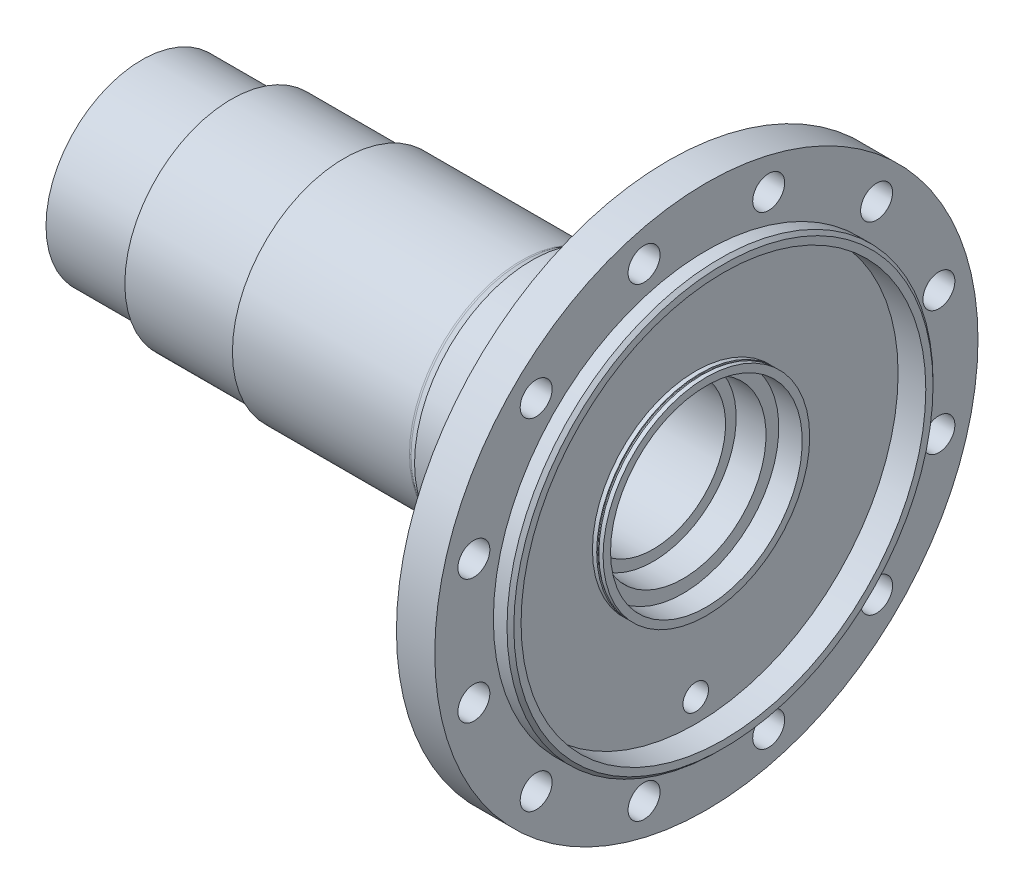
from build123d import *

# Parameters (mm, degrees)
SKETCH_3_W           = 2
SKETCH_3_H           = 46.5
SKETCH_5_W           = 2
SKETCH_5_H           = 46.5
SKETCH_6_R           = 7.5
CUT_EXTRUDE_1_DEPTH  = 328.171973127
SKETCH_7_R           = 7.5
CUT_EXTRUDE_2_DEPTH  = 328.171973127
SKETCH_8_R           = 7.5
CUT_EXTRUDE_3_DEPTH  = 328.171973127
SKETCH_9_R           = 7.5
CUT_EXTRUDE_4_DEPTH  = 328.171973127
SKETCH_10_R          = 7.5
CUT_EXTRUDE_5_DEPTH  = 328.171973127
SKETCH_11_R          = 7.5
CUT_EXTRUDE_6_DEPTH  = 328.171973127
SKETCH_12_R          = 7.5
CUT_EXTRUDE_7_DEPTH  = 328.171973127
SKETCH_13_R          = 7.5
CUT_EXTRUDE_8_DEPTH  = 328.171973127
SKETCH_14_R          = 7.5
CUT_EXTRUDE_9_DEPTH  = 328.171973127
SKETCH_15_R          = 7.5
CUT_EXTRUDE_10_DEPTH = 328.171973127
SKETCH_16_R          = 7.5
CUT_EXTRUDE_11_DEPTH = 328.171973127
SKETCH_17_R          = 7.5
CUT_EXTRUDE_12_DEPTH = 328.171973127
SKETCH_18_R          = 6
CUT_EXTRUDE_13_DEPTH = 328.171973127


with BuildPart() as part:
    # Эскиз1 → Повернуть1 (revolve)
    with BuildSketch(Plane.XY, mode=Mode.PRIVATE) as revolve_1_sk:
        with BuildLine():
            Line((0, 0), (273, 0))
            Line((273, 0), (273, 98.4))
            Line((273, 98.4), (271.4, 100))
            Line((271.4, 100), (265, 100))
            Line((265, 100), (265, 127.5))
            Line((265, 127.5), (247, 127.5))
            Line((247, 127.5), (247, 94.828427125))
            ThreePointArc((247, 94.828427125), (246.847759065, 94.06306026), (246.414213562, 93.414213562))
            Line((246.414213562, 93.414213562), (245, 92))
            Line((245, 92), (245, 82.828427125))
            ThreePointArc((245, 82.828427125), (244.847759065, 82.06306026), (244.414213562, 81.414213562))
            Line((244.414213562, 81.414213562), (241, 78))
            Line((241, 78), (241, 68.328427125))
            ThreePointArc((241, 68.328427125), (240.847759065, 67.56306026), (240.414213562, 66.914213562))
            Line((240.414213562, 66.914213562), (239, 65.5))
            Line((239, 65.5), (239, 64.5))
            ThreePointArc((239, 64.5), (238.414213562, 63.085786438), (237, 62.5))
            Line((237, 62.5), (218, 62.5))
            Line((218, 62.5), (215, 60.767949192))
            Line((215, 60.767949192), (215, 57))
            ThreePointArc((215, 57), (214.414213562, 55.585786438), (213, 55))
            Line((213, 55), (183, 55))
            Line((183, 55), (179.133974596, 52.767949192))
            ThreePointArc((179.133974596, 52.767949192), (178.651612686, 52.568148347), (178.133974596, 52.5))
            Line((178.133974596, 52.5), (95, 52.5))
            Line((95, 52.5), (95, 50))
            Line((95, 50), (42, 50))
            Line((42, 50), (42, 45))
            Line((42, 45), (0, 45))
            Line((0, 45), (0, 0))
        make_face()
    revolve(revolve_1_sk.sketch.rotate(Axis((0, 0, 0), (1, 0, 0)), 90), axis=Axis((0, 0, 0), (1, 0, 0)))

    # Эскиз2 → Вырез-Повернуть1 (revolve, cut)
    with BuildSketch(Plane.XY, mode=Mode.PRIVATE) as cut_revolve_1_sk:
        Polygon((0, 0), (273, 0), (273, 95), (265, 95), (265, 45), (254, 45), (254, 39), (240, 39), (240, 34), (203.5, 34), (203.5, 31), (0, 31), align=None)
    revolve(cut_revolve_1_sk.sketch.rotate(Axis((0, 0, 0), (1, 0, 0)), 90), axis=Axis((0, 0, 0), (1, 0, 0)), mode=Mode.SUBTRACT)

    # Эскиз3 → Rear_recess_left (revolve, cut)
    with BuildSketch(Plane.XY, mode=Mode.PRIVATE) as rear_recess_left_sk:
        with Locations((261, 71.75)):
            Rectangle(SKETCH_3_W, SKETCH_3_H)
    revolve(rear_recess_left_sk.sketch.rotate(Axis((0, 0, 0), (1, 0, 0)), 90), axis=Axis((0, 0, 0), (1, 0, 0)), mode=Mode.SUBTRACT)

    # Эскиз4 → Collar_groove_nominal (revolve, cut)
    with BuildSketch(Plane.XY, mode=Mode.PRIVATE) as collar_groove_nominal_sk:
        with BuildLine():
            Line((263, 48), (263, 95))
            Line((263, 95), (262, 95))
            Line((262, 95), (262, 48))
            ThreePointArc((262, 48), (262.146446609, 47.646446609), (262.5, 47.5))
            ThreePointArc((262.5, 47.5), (262.853553391, 47.646446609), (263, 48))
        make_face()
    revolve(collar_groove_nominal_sk.sketch.rotate(Axis((0, 0, 0), (1, 0, 0)), 90), axis=Axis((0, 0, 0), (1, 0, 0)), mode=Mode.SUBTRACT)

    # Эскиз5 → Rear_recess_lip (revolve, cut)
    with BuildSketch(Plane.XY, mode=Mode.PRIVATE) as rear_recess_lip_sk:
        with Locations((264, 71.75)):
            Rectangle(SKETCH_5_W, SKETCH_5_H)
    revolve(rear_recess_lip_sk.sketch.rotate(Axis((0, 0, 0), (1, 0, 0)), 90), axis=Axis((0, 0, 0), (1, 0, 0)), mode=Mode.SUBTRACT)

    # Эскиз6 → Вырез-Вытянуть1 (cut, through all)
    with BuildSketch(Plane(origin=(0, 0, 0), x_dir=(0, 0, -1), z_dir=(1, 0, 0))):
        with Locations(Location((109.149618371, 29.246552097, 0), (0, 0, 180))):
            Circle(SKETCH_6_R)
    extrude(amount=CUT_EXTRUDE_1_DEPTH, mode=Mode.SUBTRACT)

    # Эскиз7 → Вырез-Вытянуть2 (cut, through all)
    with BuildSketch(Plane(origin=(0, 0, 0), x_dir=(0, 0, -1), z_dir=(1, 0, 0))):
        with Locations(Location((79.903066274, 79.903066274, 0), (0, 0, 180))):
            Circle(SKETCH_7_R)
    extrude(amount=CUT_EXTRUDE_2_DEPTH, mode=Mode.SUBTRACT)

    # Эскиз8 → Вырез-Вытянуть3 (cut, through all)
    with BuildSketch(Plane(origin=(0, 0, 0), x_dir=(0, 0, -1), z_dir=(1, 0, 0))):
        with Locations(Location((29.246552097, 109.149618371, 0), (0, 0, 180))):
            Circle(SKETCH_8_R)
    extrude(amount=CUT_EXTRUDE_3_DEPTH, mode=Mode.SUBTRACT)

    # Эскиз9 → Вырез-Вытянуть4 (cut, through all)
    with BuildSketch(Plane(origin=(0, 0, 0), x_dir=(0, 0, -1), z_dir=(1, 0, 0))):
        with Locations(Location((-29.246552097, 109.149618371, 0), (0, 0, 180))):
            Circle(SKETCH_9_R)
    extrude(amount=CUT_EXTRUDE_4_DEPTH, mode=Mode.SUBTRACT)

    # Эскиз10 → Вырез-Вытянуть5 (cut, through all)
    with BuildSketch(Plane(origin=(0, 0, 0), x_dir=(0, 0, -1), z_dir=(1, 0, 0))):
        with Locations(Location((-79.903066274, 79.903066274, 0), (0, 0, 180))):
            Circle(SKETCH_10_R)
    extrude(amount=CUT_EXTRUDE_5_DEPTH, mode=Mode.SUBTRACT)

    # Эскиз11 → Вырез-Вытянуть6 (cut, through all)
    with BuildSketch(Plane(origin=(0, 0, 0), x_dir=(0, 0, -1), z_dir=(1, 0, 0))):
        with Locations(Location((-109.149618371, 29.246552097, 0), (0, 0, 180))):
            Circle(SKETCH_11_R)
    extrude(amount=CUT_EXTRUDE_6_DEPTH, mode=Mode.SUBTRACT)

    # Эскиз12 → Вырез-Вытянуть7 (cut, through all)
    with BuildSketch(Plane(origin=(0, 0, 0), x_dir=(0, 0, -1), z_dir=(1, 0, 0))):
        with Locations(Location((-109.149618371, -29.246552097, 0), (0, 0, 180))):
            Circle(SKETCH_12_R)
    extrude(amount=CUT_EXTRUDE_7_DEPTH, mode=Mode.SUBTRACT)

    # Эскиз13 → Вырез-Вытянуть8 (cut, through all)
    with BuildSketch(Plane(origin=(0, 0, 0), x_dir=(0, 0, -1), z_dir=(1, 0, 0))):
        with Locations(Location((-79.903066274, -79.903066274, 0), (0, 0, 180))):
            Circle(SKETCH_13_R)
    extrude(amount=CUT_EXTRUDE_8_DEPTH, mode=Mode.SUBTRACT)

    # Эскиз14 → Вырез-Вытянуть9 (cut, through all)
    with BuildSketch(Plane(origin=(0, 0, 0), x_dir=(0, 0, -1), z_dir=(1, 0, 0))):
        with Locations(Location((-29.246552097, -109.149618371, 0), (0, 0, 180))):
            Circle(SKETCH_14_R)
    extrude(amount=CUT_EXTRUDE_9_DEPTH, mode=Mode.SUBTRACT)

    # Эскиз15 → Вырез-Вытянуть10 (cut, through all)
    with BuildSketch(Plane(origin=(0, 0, 0), x_dir=(0, 0, -1), z_dir=(1, 0, 0))):
        with Locations(Location((29.246552097, -109.149618371, 0), (0, 0, 180))):
            Circle(SKETCH_15_R)
    extrude(amount=CUT_EXTRUDE_10_DEPTH, mode=Mode.SUBTRACT)

    # Эскиз16 → Вырез-Вытянуть11 (cut, through all)
    with BuildSketch(Plane(origin=(0, 0, 0), x_dir=(0, 0, -1), z_dir=(1, 0, 0))):
        with Locations(Location((79.903066274, -79.903066274, 0), (0, 0, 180))):
            Circle(SKETCH_16_R)
    extrude(amount=CUT_EXTRUDE_11_DEPTH, mode=Mode.SUBTRACT)

    # Эскиз17 → Вырез-Вытянуть12 (cut, through all)
    with BuildSketch(Plane(origin=(0, 0, 0), x_dir=(0, 0, -1), z_dir=(1, 0, 0))):
        with Locations(Location((109.149618371, -29.246552097, 0), (0, 0, 180))):
            Circle(SKETCH_17_R)
    extrude(amount=CUT_EXTRUDE_12_DEPTH, mode=Mode.SUBTRACT)

    # Эскиз18 → Вырез-Вытянуть13 (cut, through all)
    with BuildSketch(Plane(origin=(0, 0, 0), x_dir=(0, 0, -1), z_dir=(1, 0, 0))):
        with Locations(Location((0, -84, 0), (0, 0, 166.725608927))):
            Circle(SKETCH_18_R)
    extrude(amount=CUT_EXTRUDE_13_DEPTH, mode=Mode.SUBTRACT)


solid = part.part
